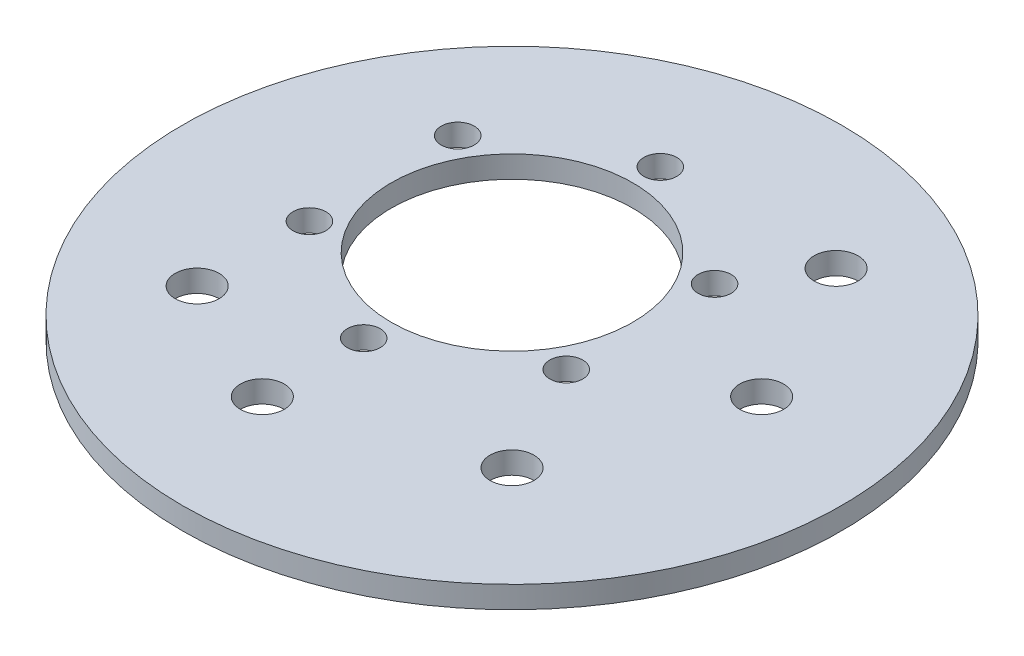
from build123d import *

# Parameters (mm, degrees)
SKETCH1_R           = 30
BOSS_EXTRUDE1_DEPTH = 2
CUT_EXTRUDE3_REACH  = 44.474
SKETCH4_R           = 11
SKETCH4_R_2         = 1.5
SKETCH4_R_3         = 2


with BuildPart() as part:
    # Sketch1 → Boss-Extrude1 (new body)
    with BuildSketch(Plane(origin=(0, 0, 0), x_dir=(1, 0, 0), z_dir=(0, 1, 0))):
        with Locations(Location((0, 0, 0), (0, 0, 270))):
            Circle(SKETCH1_R)
    extrude(amount=BOSS_EXTRUDE1_DEPTH)

    # Sketch4 → Cut-Extrude3 (cut, up to next)
    with BuildSketch(Plane(origin=(0, 2, 0), x_dir=(1, 0, 0), z_dir=(0, 1, 0)), mode=Mode.PRIVATE) as cut_extrude3_sk1:
        with Locations(Location((-4.949747468, 4.949747468, 0), (0, 0, 270))):
            Circle(SKETCH4_R)
    cut_extrude3_tool1 = extrude(cut_extrude3_sk1.sketch, amount=-CUT_EXTRUDE3_REACH, mode=Mode.PRIVATE) & part.part
    # Sketch4 → Cut-Extrude3 (cut, up to next)
    with BuildSketch(Plane(origin=(0, 2, 0), x_dir=(1, 0, 0), z_dir=(0, 1, 0)), mode=Mode.PRIVATE) as cut_extrude3_sk2:
        with Locations(Location((-4.949747468, 18.449747468, 0), (0, 0, 270))):
            Circle(SKETCH4_R_2)
    cut_extrude3_tool2 = extrude(cut_extrude3_sk2.sketch, amount=-CUT_EXTRUDE3_REACH, mode=Mode.PRIVATE) & part.part
    # Sketch4 → Cut-Extrude3 (cut, up to next)
    with BuildSketch(Plane(origin=(0, 2, 0), x_dir=(1, 0, 0), z_dir=(0, 1, 0)), mode=Mode.PRIVATE) as cut_extrude3_sk3:
        with Locations(Location((6.741595483, 11.699747468, 0), (0, 0, 270))):
            Circle(SKETCH4_R_2)
    cut_extrude3_tool3 = extrude(cut_extrude3_sk3.sketch, amount=-CUT_EXTRUDE3_REACH, mode=Mode.PRIVATE) & part.part
    # Sketch4 → Cut-Extrude3 (cut, up to next)
    with BuildSketch(Plane(origin=(0, 2, 0), x_dir=(1, 0, 0), z_dir=(0, 1, 0)), mode=Mode.PRIVATE) as cut_extrude3_sk4:
        with Locations(Location((6.741595483, -1.800252532, 0), (0, 0, 270))):
            Circle(SKETCH4_R_2)
    cut_extrude3_tool4 = extrude(cut_extrude3_sk4.sketch, amount=-CUT_EXTRUDE3_REACH, mode=Mode.PRIVATE) & part.part
    # Sketch4 → Cut-Extrude3 (cut, up to next)
    with BuildSketch(Plane(origin=(0, 2, 0), x_dir=(1, 0, 0), z_dir=(0, 1, 0)), mode=Mode.PRIVATE) as cut_extrude3_sk5:
        with Locations(Location((-4.949747468, -8.550252532, 0), (0, 0, 270))):
            Circle(SKETCH4_R_2)
    cut_extrude3_tool5 = extrude(cut_extrude3_sk5.sketch, amount=-CUT_EXTRUDE3_REACH, mode=Mode.PRIVATE) & part.part
    # Sketch4 → Cut-Extrude3 (cut, up to next)
    with BuildSketch(Plane(origin=(0, 2, 0), x_dir=(1, 0, 0), z_dir=(0, 1, 0)), mode=Mode.PRIVATE) as cut_extrude3_sk6:
        with Locations(Location((-16.641090419, -1.800252532, 0), (0, 0, 270))):
            Circle(SKETCH4_R_2)
    cut_extrude3_tool6 = extrude(cut_extrude3_sk6.sketch, amount=-CUT_EXTRUDE3_REACH, mode=Mode.PRIVATE) & part.part
    # Sketch4 → Cut-Extrude3 (cut, up to next)
    with BuildSketch(Plane(origin=(0, 2, 0), x_dir=(1, 0, 0), z_dir=(0, 1, 0)), mode=Mode.PRIVATE) as cut_extrude3_sk7:
        with Locations(Location((-16.641090419, 11.699747468, 0), (0, 0, 270))):
            Circle(SKETCH4_R_2)
    cut_extrude3_tool7 = extrude(cut_extrude3_sk7.sketch, amount=-CUT_EXTRUDE3_REACH, mode=Mode.PRIVATE) & part.part
    # Sketch4 → Cut-Extrude3 (cut, up to next)
    with BuildSketch(Plane(origin=(0, 2, 0), x_dir=(1, 0, 0), z_dir=(0, 1, 0)), mode=Mode.PRIVATE) as cut_extrude3_sk8:
        with Locations(Location((-4.949747468, -17.777677021, 0), (0, 0, 270))):
            Circle(SKETCH4_R_3)
    cut_extrude3_tool8 = extrude(cut_extrude3_sk8.sketch, amount=-CUT_EXTRUDE3_REACH, mode=Mode.PRIVATE) & part.part
    # Sketch4 → Cut-Extrude3 (cut, up to next)
    with BuildSketch(Plane(origin=(0, 2, 0), x_dir=(1, 0, 0), z_dir=(0, 1, 0)), mode=Mode.PRIVATE) as cut_extrude3_sk9:
        with Locations(Location((12.02081528, -12.02081528, 0), (0, 0, 270))):
            Circle(SKETCH4_R_3)
    cut_extrude3_tool9 = extrude(cut_extrude3_sk9.sketch, amount=-CUT_EXTRUDE3_REACH, mode=Mode.PRIVATE) & part.part
    # Sketch4 → Cut-Extrude3 (cut, up to next)
    with BuildSketch(Plane(origin=(0, 2, 0), x_dir=(1, 0, 0), z_dir=(0, 1, 0)), mode=Mode.PRIVATE) as cut_extrude3_sk10:
        with Locations(Location((17.777677021, 4.949747468, 0), (0, 0, 270))):
            Circle(SKETCH4_R_3)
    cut_extrude3_tool10 = extrude(cut_extrude3_sk10.sketch, amount=-CUT_EXTRUDE3_REACH, mode=Mode.PRIVATE) & part.part
    # Sketch4 → Cut-Extrude3 (cut, up to next)
    with BuildSketch(Plane(origin=(0, 2, 0), x_dir=(1, 0, 0), z_dir=(0, 1, 0)), mode=Mode.PRIVATE) as cut_extrude3_sk11:
        with Locations(Location((11.050252532, 18.449747468, 0), (0, 0, 270))):
            Circle(SKETCH4_R_3)
    cut_extrude3_tool11 = extrude(cut_extrude3_sk11.sketch, amount=-CUT_EXTRUDE3_REACH, mode=Mode.PRIVATE) & part.part
    # Sketch4 → Cut-Extrude3 (cut, up to next)
    with BuildSketch(Plane(origin=(0, 2, 0), x_dir=(1, 0, 0), z_dir=(0, 1, 0)), mode=Mode.PRIVATE) as cut_extrude3_sk12:
        with Locations(Location((-16.641090419, -12.02081528, 0), (0, 0, 270))):
            Circle(SKETCH4_R_3)
    cut_extrude3_tool12 = extrude(cut_extrude3_sk12.sketch, amount=-CUT_EXTRUDE3_REACH, mode=Mode.PRIVATE) & part.part
    add(cut_extrude3_tool1.solids().sort_by_distance((-4.949747, 2, -4.949747))[0], mode=Mode.SUBTRACT)
    add(cut_extrude3_tool2.solids().sort_by_distance((-4.949747, 2, -18.449747))[0], mode=Mode.SUBTRACT)
    add(cut_extrude3_tool3.solids().sort_by_distance((6.741595, 2, -11.699747))[0], mode=Mode.SUBTRACT)
    add(cut_extrude3_tool4.solids().sort_by_distance((6.741595, 2, 1.800253))[0], mode=Mode.SUBTRACT)
    add(cut_extrude3_tool5.solids().sort_by_distance((-4.949747, 2, 8.550253))[0], mode=Mode.SUBTRACT)
    add(cut_extrude3_tool6.solids().sort_by_distance((-16.64109, 2, 1.800253))[0], mode=Mode.SUBTRACT)
    add(cut_extrude3_tool7.solids().sort_by_distance((-16.64109, 2, -11.699747))[0], mode=Mode.SUBTRACT)
    add(cut_extrude3_tool8.solids().sort_by_distance((-4.949747, 2, 17.777677))[0], mode=Mode.SUBTRACT)
    add(cut_extrude3_tool9.solids().sort_by_distance((12.020815, 2, 12.020815))[0], mode=Mode.SUBTRACT)
    add(cut_extrude3_tool10.solids().sort_by_distance((17.777677, 2, -4.949747))[0], mode=Mode.SUBTRACT)
    add(cut_extrude3_tool11.solids().sort_by_distance((11.050253, 2, -18.449747))[0], mode=Mode.SUBTRACT)
    add(cut_extrude3_tool12.solids().sort_by_distance((-16.64109, 2, 12.020815))[0], mode=Mode.SUBTRACT)


solid = part.part
